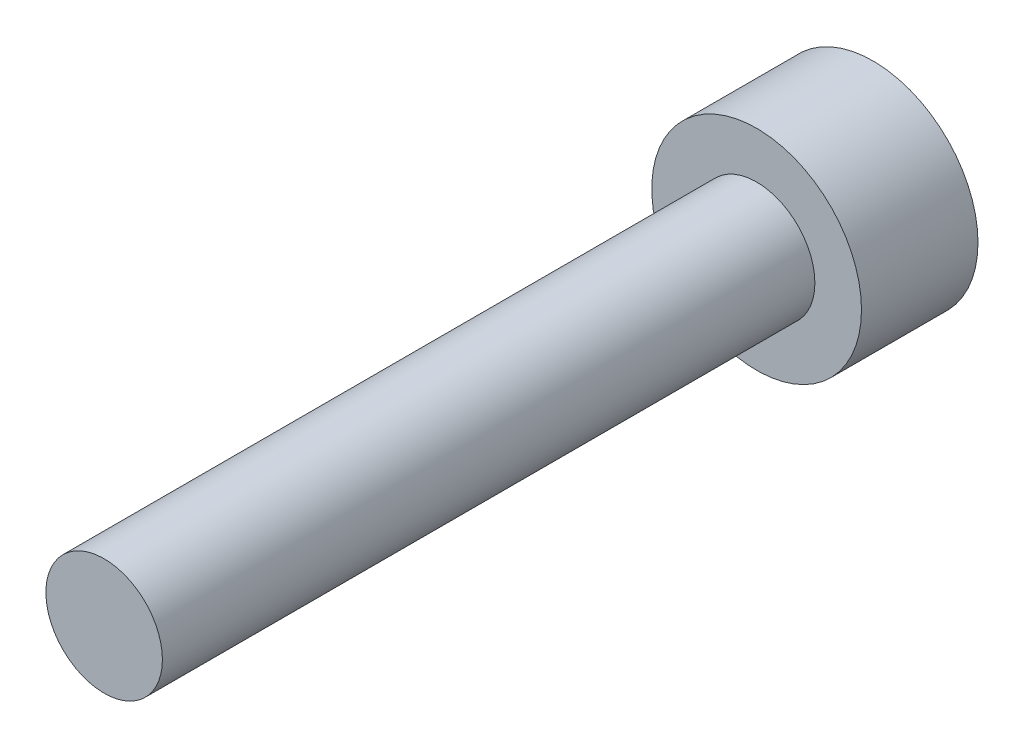
from build123d import *

# Parameters (mm, degrees)
CABEZA_START            = -2.5
SK_CABEZA_R             = 2.25
CABEZA_DEPTH            = 2.5
SK_CUERPO_R             = 1.25
CUERPO_DEPTH            = 14
HEXAGONO_INTERIOR_START = -2.5
HEXAGONO_INTERIOR_DEPTH = 1.25


with BuildPart() as part:
    # Sk_Cabeza → Cabeza (new body)
    with BuildSketch(Plane.XY.offset(CABEZA_START)):
        Circle(SK_CABEZA_R)
    extrude(amount=CABEZA_DEPTH)

    # Sk_Cuerpo → Cuerpo (add)
    with BuildSketch(Plane.XY):
        Circle(SK_CUERPO_R)
    extrude(amount=CUERPO_DEPTH)

    # Sk_Hexagono_interior → Hexagono_interior (cut)
    with BuildSketch(Plane.XY.offset(HEXAGONO_INTERIOR_START)):
        Polygon((0, -1.154700538), (1, -0.577350269), (1, 0.577350269), (0, 1.154700538), (-1, 0.577350269), (-1, -0.577350269), align=None)
    extrude(amount=HEXAGONO_INTERIOR_DEPTH, mode=Mode.SUBTRACT)


solid = part.part
